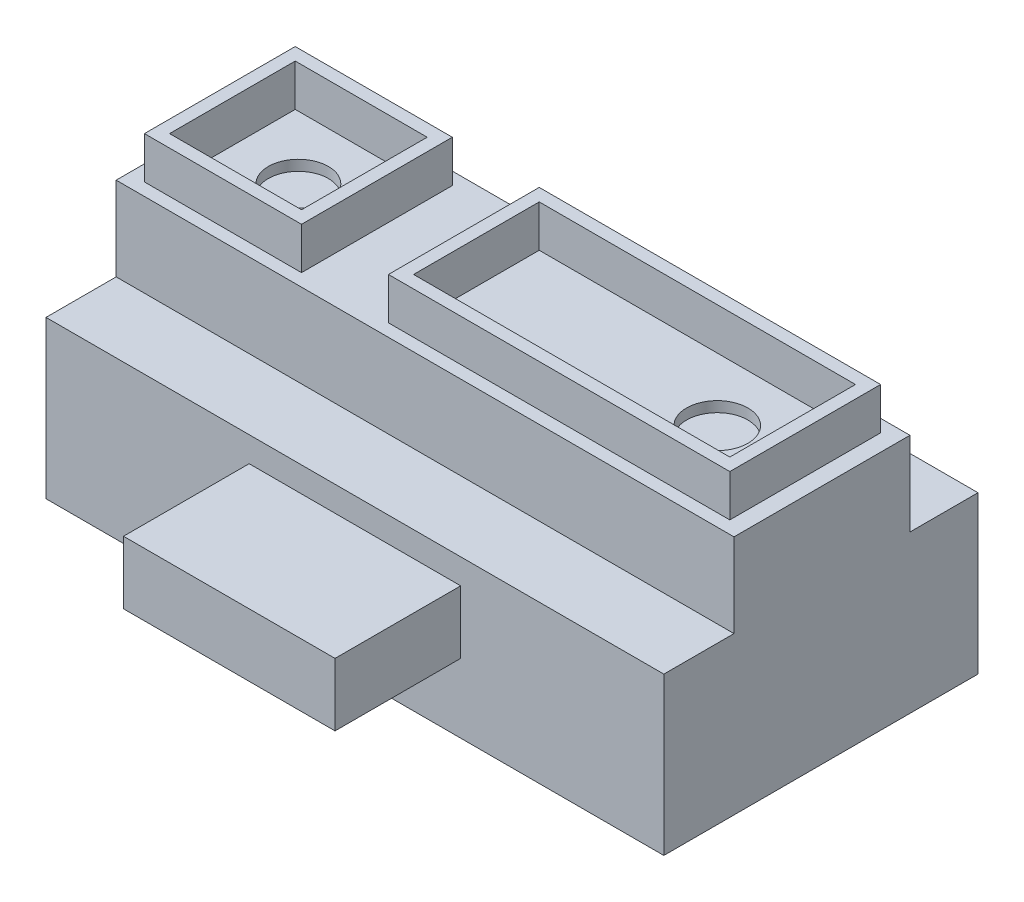
from build123d import *

# Parameters (mm, degrees)
SKIZZE2_W                       = 29.5
SKIZZE2_H                       = 15
AUFSATZ_LINEAR_AUSTRAGEN1_DEPTH = 7.5
SKIZZE4_W                       = 27.9
SKIZZE4_H                       = 13.4
SCHNITT_LINEAR_AUSTRAGEN1_DEPTH = 5.7
SKIZZE5_W                       = 29.5
SKIZZE5_H                       = 8.4
AUFSATZ_LINEAR_AUSTRAGEN2_DEPTH = 4
SKIZZE7_W                       = 7.5
SKIZZE7_H                       = 7.2
SKIZZE7_W_2                     = 6.3
SKIZZE7_H_2                     = 6
SKIZZE7_W_3                     = 16.3
SKIZZE7_W_4                     = 15.1
AUFSATZ_LINEAR_AUSTRAGEN3_DEPTH = 2
SKIZZE8_R                       = 1.434086585
SKIZZE8_R_2                     = 1.463442441
SCHNITT_LINEAR_AUSTRAGEN2_DEPTH = 0.5
SKIZZE9_W                       = 10.1
SKIZZE9_H                       = 3
AUFSATZ_LINEAR_AUSTRAGEN4_DEPTH = 6


with BuildPart() as part:
    # Skizze2 → Aufsatz-Linear austragen1 (new body)
    with BuildSketch(Plane(origin=(0, 0, 0), x_dir=(1, 0, 0), z_dir=(0, 1, 0))):
        with Locations((14.75, 7.5)):
            Rectangle(SKIZZE2_W, SKIZZE2_H)
    extrude(amount=AUFSATZ_LINEAR_AUSTRAGEN1_DEPTH)

    # Skizze4 → Schnitt-Linear austragen1 (cut)
    with BuildSketch(Plane.XZ):
        with Locations((14.75, -7.5)):
            Rectangle(SKIZZE4_W, SKIZZE4_H)
    extrude(amount=-SCHNITT_LINEAR_AUSTRAGEN1_DEPTH, mode=Mode.SUBTRACT)

    # Skizze5 → Aufsatz-Linear austragen2 (add)
    with BuildSketch(Plane(origin=(0, 7.5, 0), x_dir=(1, 0, 0), z_dir=(0, 1, 0))):
        with Locations((14.75, 7.55)):
            Rectangle(SKIZZE5_W, SKIZZE5_H)
    extrude(amount=AUFSATZ_LINEAR_AUSTRAGEN2_DEPTH)

    # Skizze7 → Aufsatz-Linear austragen3 (add)
    # profile 1 of 2: a face of its own
    with BuildSketch(Plane(origin=(0, 11.5, 0), x_dir=(1, 0, 0), z_dir=(0, 1, 0))):
        with Locations((4.5, 7.55)):
            Rectangle(SKIZZE7_W, SKIZZE7_H)
        with Locations((4.5, 7.55)):
            Rectangle(SKIZZE7_W_2, SKIZZE7_H_2, mode=Mode.SUBTRACT)
    # profile 2 of 2: a face of its own
    with BuildSketch(Plane(origin=(0, 11.5, 0), x_dir=(1, 0, 0), z_dir=(0, 1, 0))):
        with Locations((20.55, 7.55)):
            Rectangle(SKIZZE7_W_3, SKIZZE7_H)
        with Locations((20.55, 7.55)):
            Rectangle(SKIZZE7_W_4, SKIZZE7_H_2, mode=Mode.SUBTRACT)
    extrude(amount=AUFSATZ_LINEAR_AUSTRAGEN3_DEPTH)

    # Skizze8 → Schnitt-Linear austragen2 (cut)
    with BuildSketch(Plane(origin=(0, 11.5, 0), x_dir=(-1, 0, 0), z_dir=(0, 1, 0))):
        with Locations(Location((-4.5, -7.55, 0), (0, 0, 90))):
            Circle(SKIZZE8_R)
        with Locations(Location((-24.5, -7.55, 0), (0, 0, 90))):
            Circle(SKIZZE8_R_2)
    extrude(amount=-SCHNITT_LINEAR_AUSTRAGEN2_DEPTH, mode=Mode.SUBTRACT)

    # Skizze9 → Aufsatz-Linear austragen4 (add)
    with BuildSketch(Plane.XY):
        with Locations((14.75, 4.8)):
            Rectangle(SKIZZE9_W, SKIZZE9_H)
    extrude(amount=AUFSATZ_LINEAR_AUSTRAGEN4_DEPTH)


solid = part.part
